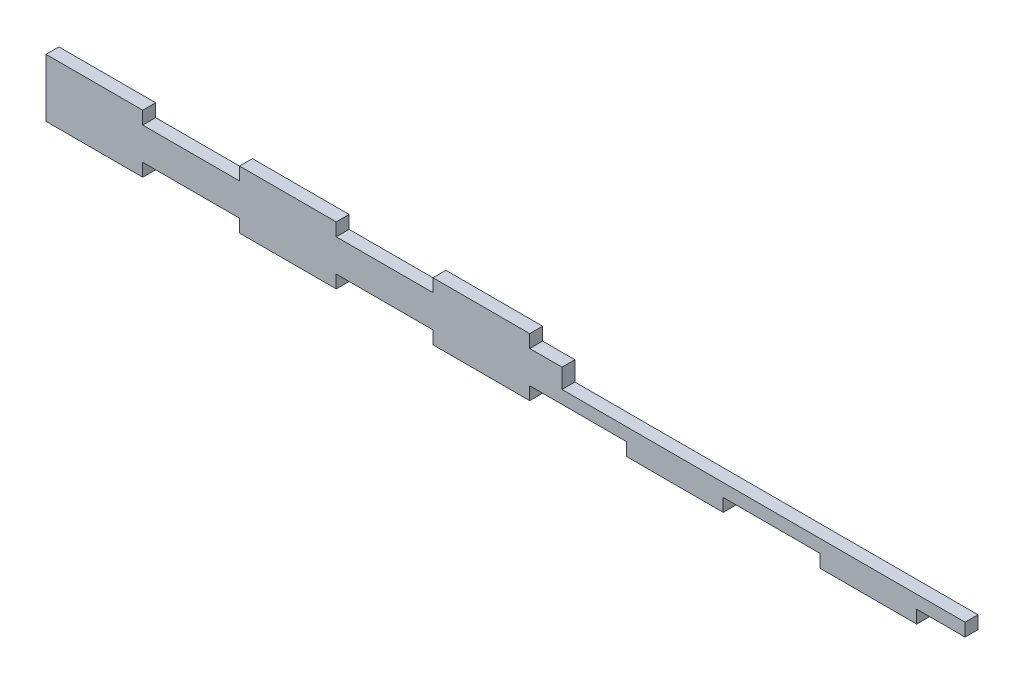
from build123d import *

# Parameters (mm, degrees)
BOSS_EXTRUDE1_DEPTH = 2
CUT_EXTRUDE1_REACH  = 137.359
SKETCH2_W           = 110
SKETCH2_H           = 10
SKETCH3_W           = 15
SKETCH3_H           = 4
BOSS_EXTRUDE2_DEPTH = 4


with BuildPart() as part:
    # Sketch1 → Boss-Extrude1 (new, symmetric)
    with BuildSketch(Plane.XY):
        Polygon((-105, -5), (-75, -5), (-75, -9), (-45, -9), (-45, -5), (-15, -5), (-15, -9), (15, -9), (15, -5), (45, -5), (45, -9), (75, -9), (75, -5), (105, -5), (105, -9), (135, -9), (135, -5), (135, 5), (135, 9), (105, 9), (105, 5), (75, 5), (75, 9), (45, 9), (45, 5), (15, 5), (15, 9), (-15, 9), (-15, 5), (-45, 5), (-45, 9), (-75, 9), (-75, 5), (-105, 5), (-105, 9), (-135, 9), (-135, 5), (-135, -5), (-135, -9), (-105, -9), align=None)
    extrude(amount=BOSS_EXTRUDE1_DEPTH, both=True)

    # Sketch2 → Cut-Extrude1 (cut, up to next)
    with BuildSketch(Plane.XY.offset(2), mode=Mode.PRIVATE) as cut_extrude1_sk1:
        with Locations((80, 4)):
            Rectangle(SKETCH2_W, SKETCH2_H)
    cut_extrude1_tool1 = extrude(cut_extrude1_sk1.sketch, amount=-CUT_EXTRUDE1_REACH, mode=Mode.PRIVATE) & part.part
    add(cut_extrude1_tool1.solids().sort_by_distance((80, 4, 2))[0], mode=Mode.SUBTRACT)

    # Sketch3 → Boss-Extrude2 (add)
    with BuildSketch(Plane.XY.offset(2)):
        with Locations((142.5, -3)):
            Rectangle(SKETCH3_W, SKETCH3_H)
    extrude(amount=-BOSS_EXTRUDE2_DEPTH)


solid = part.part
